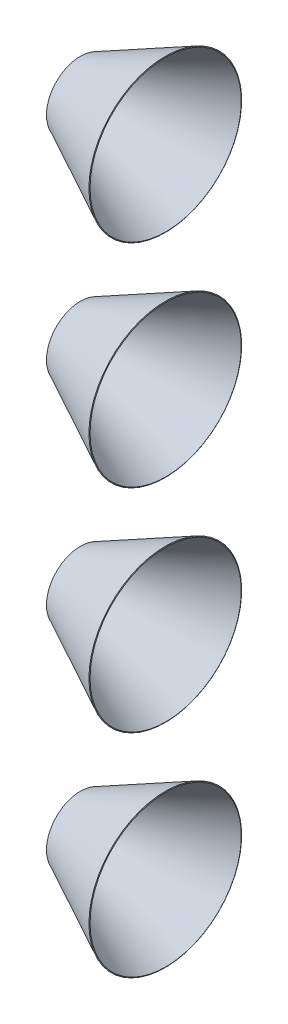
from build123d import *


with BuildPart() as part:
    # 草图1 → 旋转-薄壁1 (revolve)
    with BuildSketch(Plane.XY, mode=Mode.PRIVATE) as revolve_1_sk:
        Polygon((1200, -335), (1300, -285), (1300.447213595, -285.894427191), (1200.447213595, -335.894427191), align=None)
    revolve(revolve_1_sk.sketch.rotate(Axis((1200, -375, 0), (1, 0, 0)), 90), axis=Axis((1200, -375, 0), (1, 0, 0)))


with BuildPart() as body_2:
    # 草图2 → 旋转-薄壁2 (revolve)
    with BuildSketch(Plane.XY, mode=Mode.PRIVATE) as revolve_2_sk:
        Polygon((1200, -85), (1300, -35), (1300.447213595, -35.894427191), (1200.447213595, -85.894427191), align=None)
    revolve(revolve_2_sk.sketch.rotate(Axis((1200, -125, 0), (1, 0, 0)), 90), axis=Axis((1200, -125, 0), (1, 0, 0)))


with BuildPart() as body_3:
    # 草图3 → 旋转-薄壁3 (revolve)
    with BuildSketch(Plane.XY, mode=Mode.PRIVATE) as revolve_3_sk:
        Polygon((1200, 165), (1300, 215), (1300.447213595, 214.105572809), (1200.447213595, 164.105572809), align=None)
    revolve(revolve_3_sk.sketch.rotate(Axis((1200, 125, 0), (1, 0, 0)), 90), axis=Axis((1200, 125, 0), (1, 0, 0)))


with BuildPart() as body_4:
    # 草图4 → 旋转-薄壁4 (revolve)
    with BuildSketch(Plane.XY, mode=Mode.PRIVATE) as revolve_4_sk:
        Polygon((1200, 415), (1300, 465), (1300.447213595, 464.105572809), (1200.447213595, 414.105572809), align=None)
    revolve(revolve_4_sk.sketch.rotate(Axis((1200, 375, 0), (1, 0, 0)), 90), axis=Axis((1200, 375, 0), (1, 0, 0)))


solid = Compound([part.part, body_2.part, body_3.part, body_4.part])
